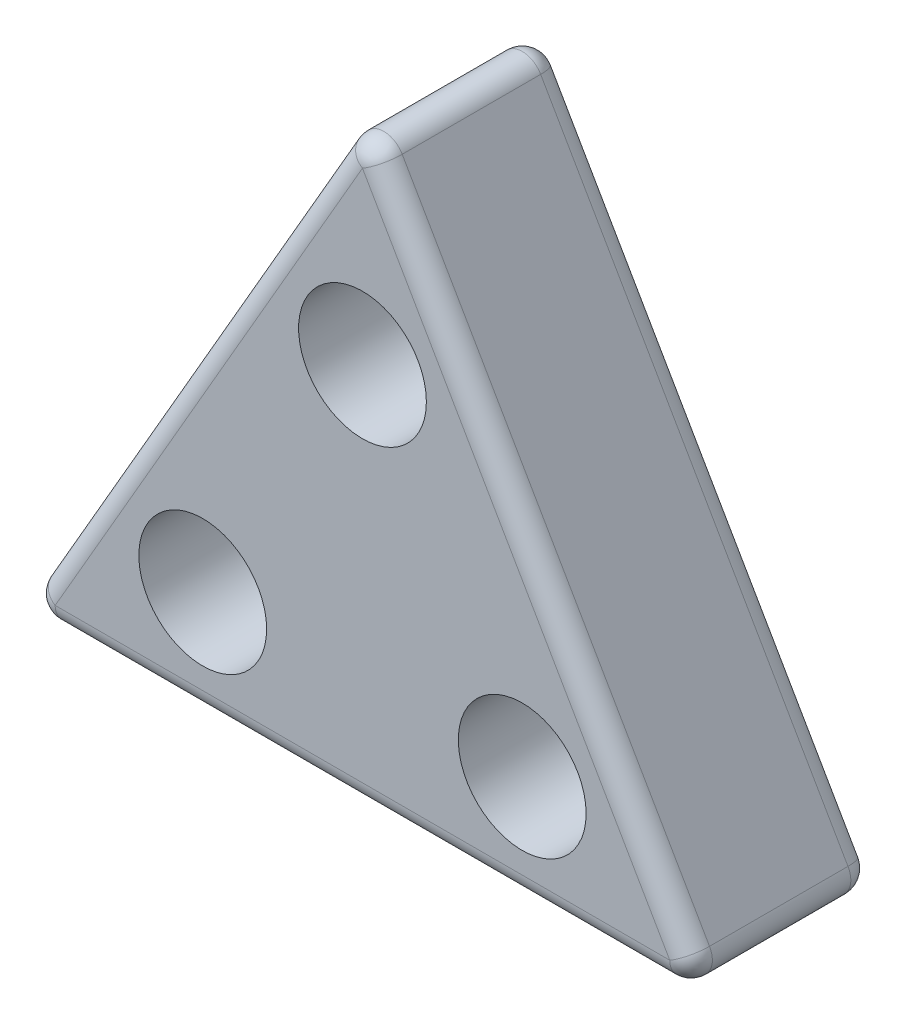
from build123d import *

# Parameters (mm, degrees)
ESQUISSE1_R        = 3
BOSS_EXTRU_1_DEPTH = 8.5
CONG_1_R           = 1


with BuildPart() as part:
    # Esquisse1 → Boss.-Extru.1 (new body)
    with BuildSketch(Plane.XY):
        with BuildLine():
            Line((0.866025404, 21.490381057), (15.294228634, -3.5))
            ThreePointArc((15.294228634, -3.5), (15.294228634, -4.5), (14.42820323, -5))
            Line((14.42820323, -5), (-14.42820323, -5))
            ThreePointArc((-14.42820323, -5), (-15.294228634, -4.5), (-15.294228634, -3.5))
            Line((-15.294228634, -3.5), (-0.866025404, 21.490381057))
            ThreePointArc((-0.866025404, 21.490381057), (0, 21.990381057), (0.866025404, 21.490381057))
        make_face()
        with Locations((-7.5, 0)):
            Circle(ESQUISSE1_R, mode=Mode.SUBTRACT)
        with Locations((7.5, 0)):
            Circle(ESQUISSE1_R, mode=Mode.SUBTRACT)
        with Locations((0, 12.990381057)):
            Circle(ESQUISSE1_R, mode=Mode.SUBTRACT)
    extrude(amount=BOSS_EXTRU_1_DEPTH)

    # Congé1
    cong_1_edges = [part.edges().sort_by_distance(p)[0] for p in [
        (-15.294228634, -4.5, 8.5),
        (0, -5, 8.5),
        (15.294228634, -4.5, 8.5),
        (8.080127019, 8.995190528, 8.5),
        (0, 21.990381057, 8.5),
        (8.080127019, 8.995190528, 0),
        (15.294228634, -4.5, 0),
        (0, -5, 0),
        (-15.294228634, -4.5, 0),
        (-8.080127019, 8.995190528, 0),
        (0, 21.990381057, 0),
        (-8.080127019, 8.995190528, 8.5),
    ]]
    fillet(cong_1_edges, radius=CONG_1_R)


solid = part.part
